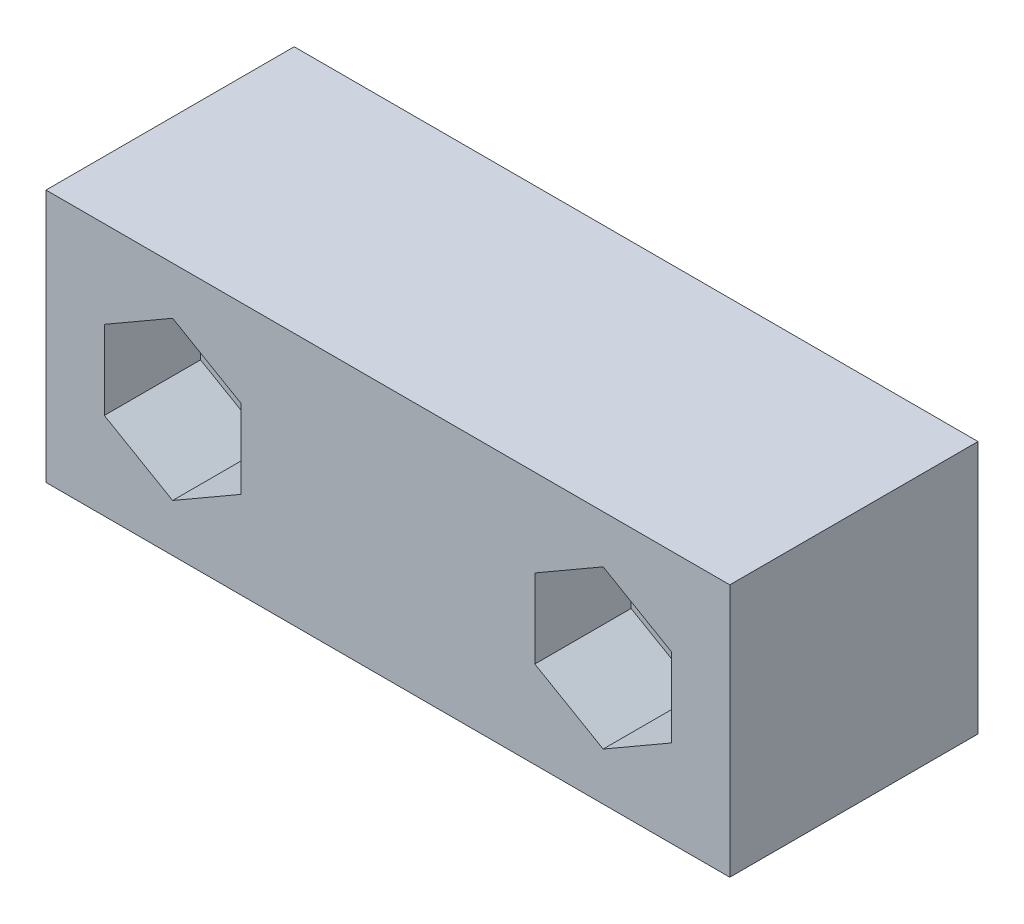
from build123d import *

# Parameters (mm, degrees)
SKETCH1_W           = 27
SKETCH1_H           = 10
BOSS_EXTRUDE1_DEPTH = 9.8
CUT_EXTRUDE1_DEPTH  = 3.8
CUT_EXTRUDE2_DEPTH  = 3.8
HOLE1_D             = 3.4
HOLE1_DEPTH         = 9.8
HOLE2_D             = 3.4
HOLE2_DEPTH         = 9.8


with BuildPart() as part:
    # Sketch1 → Boss-Extrude1 (new body)
    with BuildSketch(Plane(origin=(0, 0, 0), x_dir=(-1, 0, 0), z_dir=(0, 0, -1))):
        with Locations((-8.5, 0)):
            Rectangle(SKETCH1_W, SKETCH1_H)
    extrude(amount=-BOSS_EXTRUDE1_DEPTH)

    # Sketch2 → Cut-Extrude1 (cut)
    with BuildSketch(Plane.XY.offset(9.8)):
        Polygon((-2.698076211, -1.557735027), (0, -3.115470054), (2.698076211, -1.557735027), (2.698076211, 1.557735027), (0, 3.115470054), (-2.698076211, 1.557735027), align=None)
    extrude(amount=-CUT_EXTRUDE1_DEPTH, mode=Mode.SUBTRACT)

    # Sketch3 → Cut-Extrude2 (cut)
    with BuildSketch(Plane.XY.offset(9.8)):
        Polygon((14.301923789, -1.557735027), (17, -3.115470054), (19.698076211, -1.557735027), (19.698076211, 1.557735027), (17, 3.115470054), (14.301923789, 1.557735027), align=None)
    extrude(amount=-CUT_EXTRUDE2_DEPTH, mode=Mode.SUBTRACT)

    # Hole1
    with Locations(Plane(origin=(0, 0, 0), x_dir=(-1, 0, 0), z_dir=(0, 0, -1))):
        with Locations((0, 0)):
            Hole(HOLE1_D / 2, depth=HOLE1_DEPTH)

    # Hole2
    with Locations(Plane(origin=(0, 0, 0), x_dir=(-1, 0, 0), z_dir=(0, 0, -1))):
        with Locations((-17, 0)):
            Hole(HOLE2_D / 2, depth=HOLE2_DEPTH)


solid = part.part
